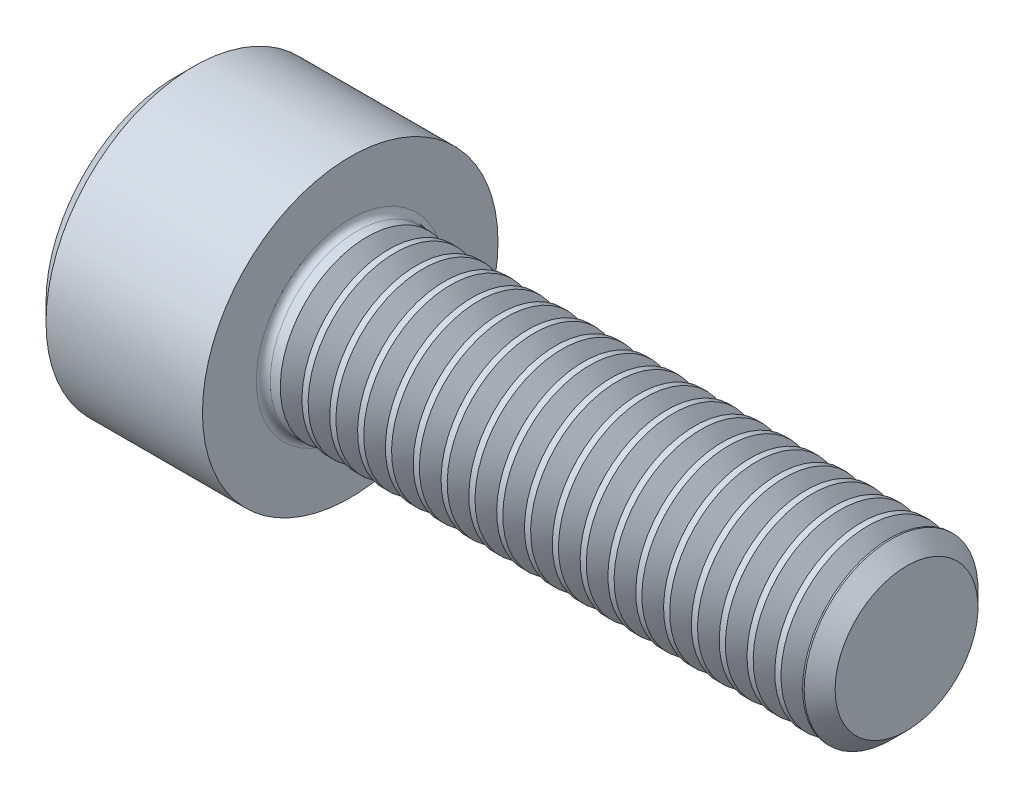
from build123d import *

# Parameters (mm, degrees)
FILLET1_R       = 0.2
HEX_2_DEPTH     = 2.5
THDSCHPAT_COUNT = 19
THDSCHPAT_PITCH = 0.8


with BuildPart() as part:
    # BodySke → Base-Revolve (revolve)
    with BuildSketch(Plane.XY, mode=Mode.PRIVATE) as base_revolve_sk:
        Polygon((0, 0), (0, 3.75), (0.5, 4.25), (5, 4.25), (5, 2.5), (20.555, 2.5), (21, 2.055), (21, 0), align=None)
    revolve(base_revolve_sk.sketch.rotate(Axis((-31.75, 0, 0), (1, 0, 0)), 90), axis=Axis((-31.75, 0, 0), (1, 0, 0)))

    # Fillet1
    fillet1_edges = [part.edges().sort_by_distance(p)[0] for p in [
        (5, 0, -2.5),
    ]]
    fillet(fillet1_edges, radius=FILLET1_R)

    # Sketch2 → Hex-PreBroach (revolve, cut)
    with BuildSketch(Plane.XY, mode=Mode.PRIVATE) as hex_prebroach_sk:
        Polygon((0, 2.042), (2.5, 2.042), (3.67894925, 0), (0, 0), align=None)
    revolve(hex_prebroach_sk.sketch.rotate(Axis((0, 0, 0), (1, 0, 0)), 90), axis=Axis((0, 0, 0), (1, 0, 0)), mode=Mode.SUBTRACT)

    # Sketch3 → Hex 2 (cut)
    with BuildSketch(Plane(origin=(0, 0, 0), x_dir=(0, 0.500000000000001, 0.866025403784438), z_dir=(-1, 0, 0))):
        Polygon((1.17894925, 2.042), (-1.17894925, 2.042), (-2.357898499, 0), (-1.17894925, -2.042), (1.17894925, -2.042), (2.357898499, 0), align=None)
    extrude(amount=-HEX_2_DEPTH, mode=Mode.SUBTRACT)

    # ThdSchSke → ThreadSchematic (revolve, cut)
    with BuildSketch(Plane.XY):
        Polygon((5.8, -2.055), (5.488407645, -2.5), (5.488407645, -3.125), (6.111592355, -3.125), (6.111592355, -2.5), align=None)
    threadschematic = revolve(axis=Axis((-3.175, 0, 0), (1, 0, 0)), mode=Mode.SUBTRACT)

    # ThdSchPat: ThreadSchematic ×19
    with Locations(*[(i * THDSCHPAT_PITCH, 0, 0) for i in range(1, THDSCHPAT_COUNT)]):
        add(threadschematic, mode=Mode.SUBTRACT)


solid = part.part
